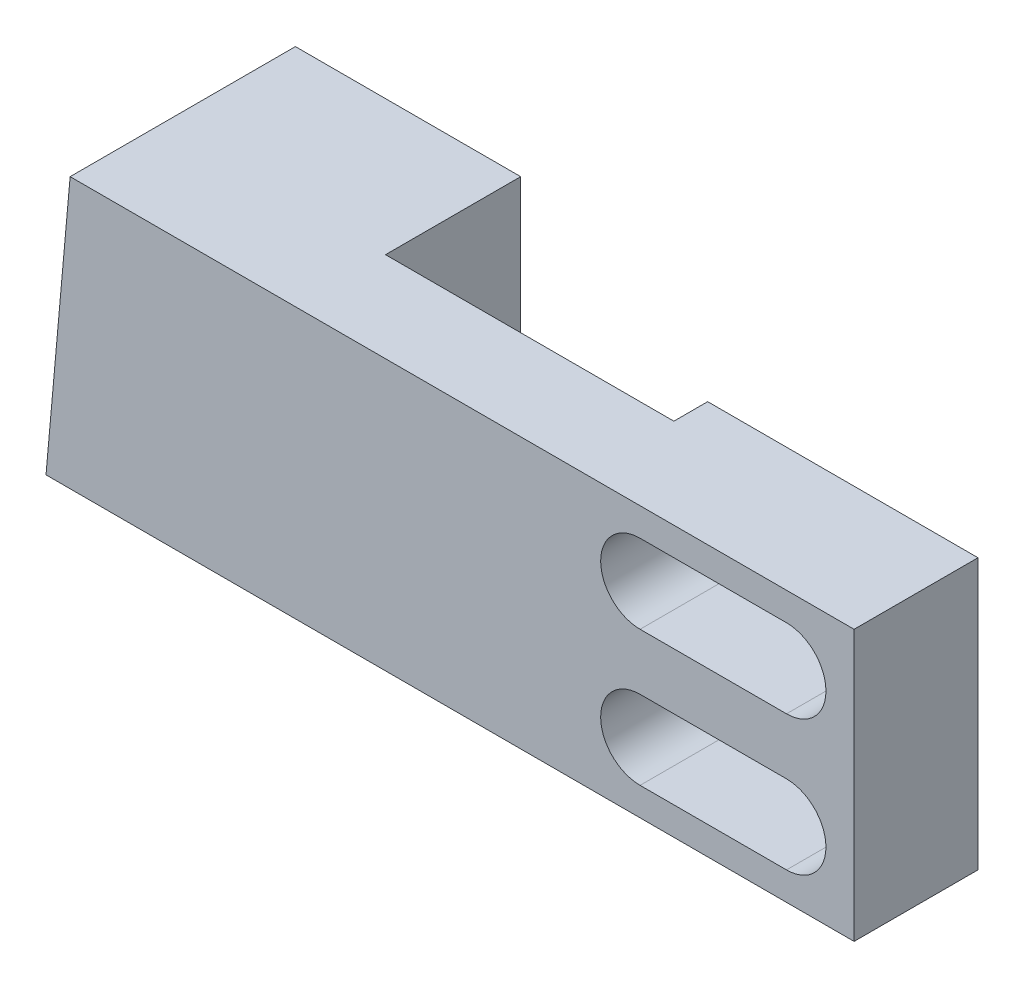
from build123d import *

# Parameters (mm, degrees)
EXTRUDE_1_DEPTH     = 10
SKETCH_2_W          = 24.8
SKETCH_2_H          = 12
EXTRUDE_2_DEPTH     = 4
SKETCH_3_W          = 12
SKETCH_3_H          = 12
EXTRUDE_3_DEPTH     = 1.5
CUT_EXTRUDE_1_DEPTH = 30.309384163


with BuildPart() as part:
    # 草图1 → 凸台-拉伸1 (new body)
    with BuildSketch(Plane.XY):
        Polygon((0, 0), (0, 12), (-10, 12), (-11.070971468, 0), align=None)
    extrude(amount=EXTRUDE_1_DEPTH)

    # 草图2 → 凸台-拉伸2 (add)
    with BuildSketch(Plane.XY.offset(10)):
        with Locations((12.4, 6)):
            Rectangle(SKETCH_2_W, SKETCH_2_H)
    extrude(amount=-EXTRUDE_2_DEPTH)

    # 草图3 → 凸台-拉伸3 (add)
    with BuildSketch(Plane(origin=(0, 0, 6), x_dir=(-1, 0, 0), z_dir=(0, 0, -1))):
        with Locations((-18.8, 6)):
            Rectangle(SKETCH_3_W, SKETCH_3_H)
    extrude(amount=EXTRUDE_3_DEPTH)

    # 草图5 → 切除-拉伸1 (cut, through all)
    with BuildSketch(Plane.XY.offset(10)):
        with BuildLine():
            Line((21.8, 7.25), (15.3, 7.25))
            ThreePointArc((15.3, 7.25), (13.55, 9), (15.3, 10.75))
            Line((15.3, 10.75), (21.8, 10.75))
            ThreePointArc((21.8, 10.75), (23.55, 9), (21.8, 7.25))
        make_face()
        with BuildLine():
            Line((21.8, 4.75), (15.3, 4.75))
            ThreePointArc((15.3, 4.75), (13.55, 3), (15.3, 1.25))
            Line((15.3, 1.25), (21.8, 1.25))
            ThreePointArc((21.8, 1.25), (23.55, 3), (21.8, 4.75))
        make_face()
    extrude(amount=-CUT_EXTRUDE_1_DEPTH, mode=Mode.SUBTRACT)


solid = part.part
